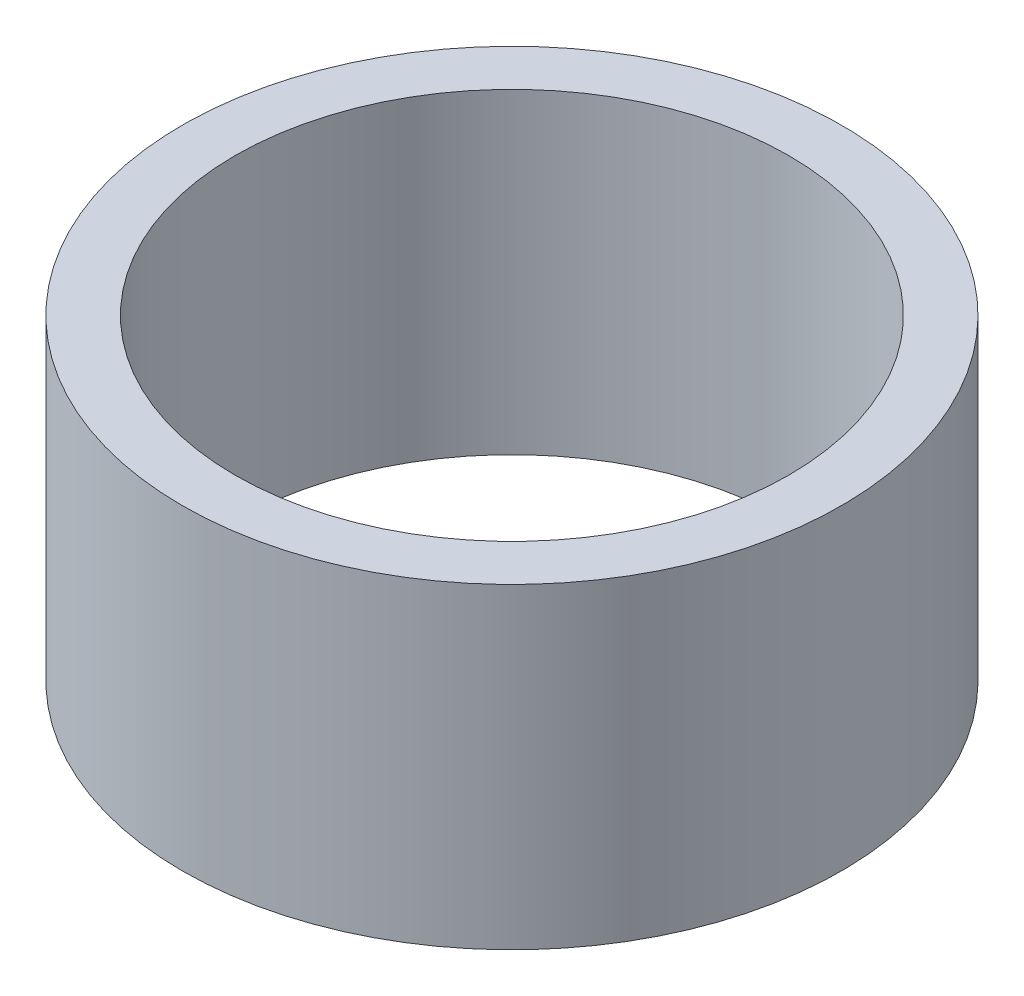
from build123d import *

# Parameters (mm, degrees)
SKETCH_1_R      = 6.25
SKETCH_1_R_2    = 5.25
EXTRUDE_1_DEPTH = 6


with BuildPart() as part:
    # Эскиз1 → Бобышка-Вытянуть1 (new body)
    with BuildSketch(Plane(origin=(0, 0, 0), x_dir=(1, 0, 0), z_dir=(0, 1, 0))):
        with Locations(Location((0, 0, 0), (0, 0, 270))):
            Circle(SKETCH_1_R)
        with Locations(Location((0, 0, 0), (0, 0, 270))):
            Circle(SKETCH_1_R_2, mode=Mode.SUBTRACT)
    extrude(amount=EXTRUDE_1_DEPTH)


solid = part.part
